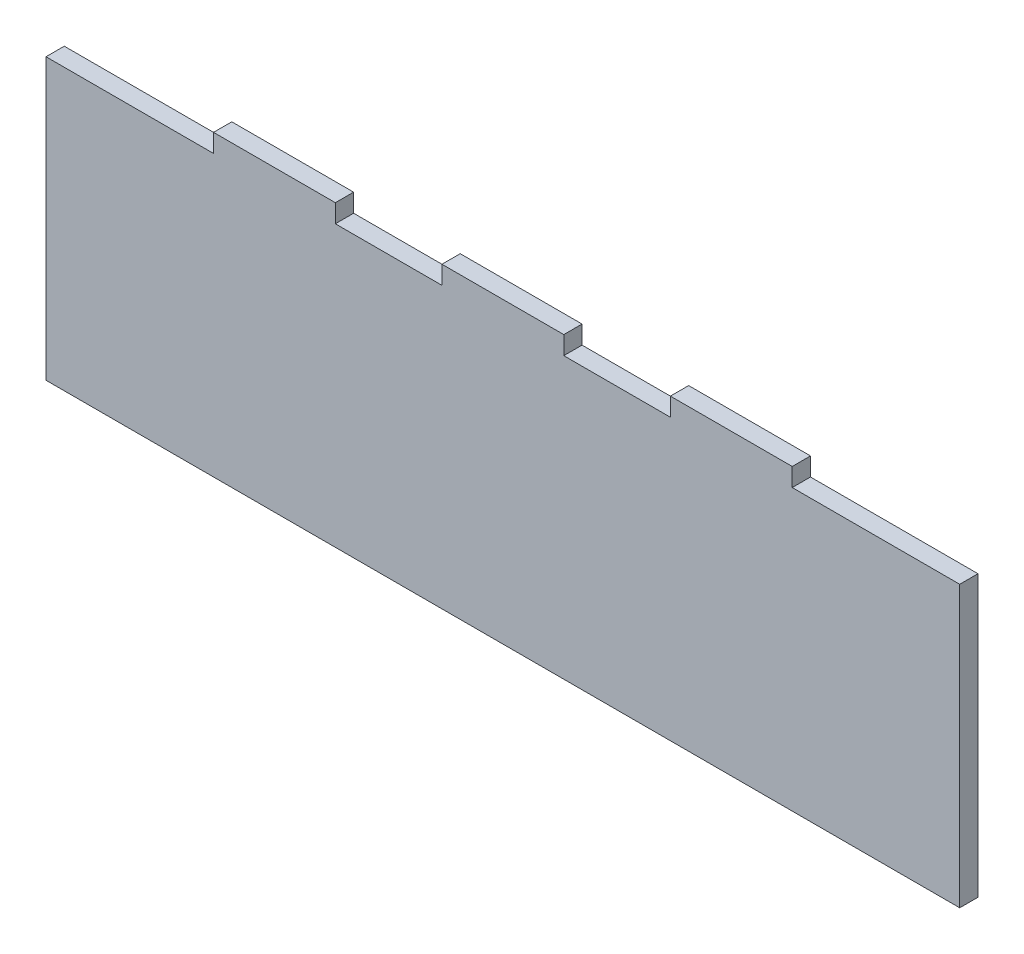
from build123d import *

# Parameters (mm, degrees)
BOSS_EXTRU_1_DEPTH = 3


with BuildPart() as part:
    # Esquisse1 → Boss.-Extru.1 (new body)
    with BuildSketch(Plane.XY):
        Polygon((75, -23), (-75, -23), (-75, 23), (-47.5, 23), (-47.5, 26), (-27.5, 26), (-27.5, 23), (-10, 23), (-10, 26), (10, 26), (10, 23), (27.5, 23), (27.5, 26), (47.5, 26), (47.5, 23), (75, 23), align=None)
    extrude(amount=BOSS_EXTRU_1_DEPTH)


solid = part.part
